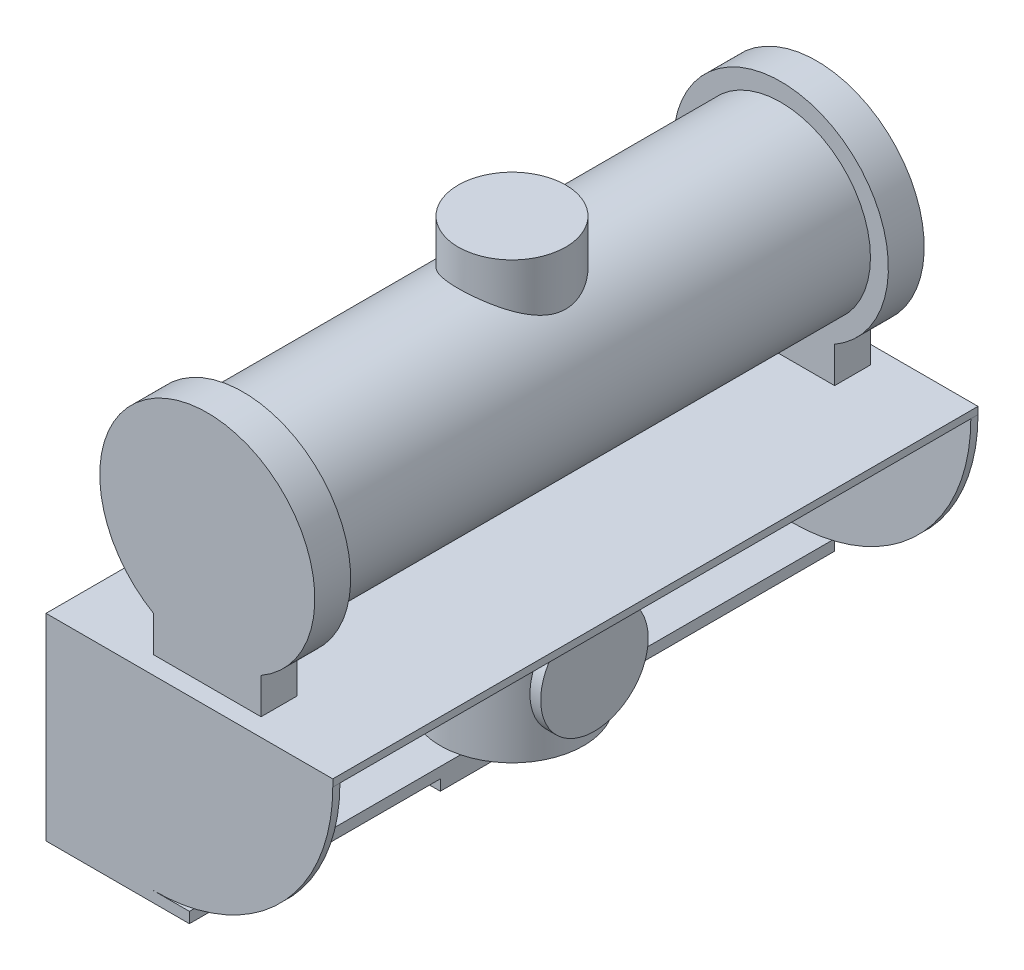
from build123d import *

# Parameters (mm, degrees)
SKETCH1_R            = 25
BOSS_EXTRUDE1_DEPTH  = 150
SKETCH2_R            = 30
BOSS_EXTRUDE2_DEPTH  = 10
BOSS_EXTRUDE3_START  = 10
SKETCH3_R            = 30
BOSS_EXTRUDE3_DEPTH  = 10
SKETCH4_R            = 15
BOSS_EXTRUDE4_DEPTH  = 10
SKETCH5_W            = 30
SKETCH5_H            = 10
BOSS_EXTRUDE5_DEPTH  = 10
SKETCH6_W            = 80
SKETCH6_H            = 180
BOSS_EXTRUDE6_DEPTH  = 2
SKETCH7_W            = 78
SKETCH7_H            = 2
BOSS_EXTRUDE7_DEPTH  = 50
FILLET1_R            = 50
SKETCH8_R            = 20
BOSS_EXTRUDE8_DEPTH  = 45
SKETCH10_R           = 15
BOSS_EXTRUDE9_DEPTH  = 3
SKETCH11_W           = 180
SKETCH11_H           = 3
BOSS_EXTRUDE10_DEPTH = 40
SKETCH12_W           = 40
SKETCH12_H           = 40
BOSS_EXTRUDE11_DEPTH = 3


with BuildPart() as part:
    # Sketch1 → Boss-Extrude1 (new body)
    with BuildSketch(Plane.XY):
        Circle(SKETCH1_R)
    extrude(amount=BOSS_EXTRUDE1_DEPTH)

    # Sketch2 → Boss-Extrude2 (add)
    with BuildSketch(Plane.XY.offset(150)):
        Circle(SKETCH2_R)
    extrude(amount=BOSS_EXTRUDE2_DEPTH)

    # Sketch3 → Boss-Extrude3 (add)
    with BuildSketch(Plane(origin=(0, 0, 0), x_dir=(-1, 0, 0), z_dir=(0, 0, -1)).offset(BOSS_EXTRUDE3_START)):
        with Locations(Location((0, 0, 0), (0, 0, 180))):
            Circle(SKETCH3_R)
    extrude(amount=-BOSS_EXTRUDE3_DEPTH)

    # Sketch4 → Boss-Extrude4 (add, symmetric)
    with BuildSketch(Plane(origin=(0, 25, 0), x_dir=(1, 0, 0), z_dir=(0, 1, 0))):
        with Locations(Location((0, -75, 0), (0, 0, 90))):
            Circle(SKETCH4_R)
    extrude(amount=BOSS_EXTRUDE4_DEPTH, both=True)

    # Sketch5 → Boss-Extrude5 (add)
    with BuildSketch(Plane.XY.offset(160)):
        with Locations((0, -30.980762114)):
            Rectangle(SKETCH5_W, SKETCH5_H)
    boss_extrude5 = extrude(amount=-BOSS_EXTRUDE5_DEPTH)

    # Mirror1: Boss-Extrude5 across plane
    add(boss_extrude5.mirror(Plane.XY.offset(75)))

    # Sketch6 → Boss-Extrude6 (add)
    with BuildSketch(Plane(origin=(0, -35.980762114, 0), x_dir=(-1, 0, 0), z_dir=(0, -1, 0))):
        with Locations((0, -75)):
            Rectangle(SKETCH6_W, SKETCH6_H)
    extrude(amount=BOSS_EXTRUDE6_DEPTH)

    # Sketch7 → Boss-Extrude7 (add)
    with BuildSketch(Plane(origin=(0, -37.980762114, 0), x_dir=(-1, 0, 0), z_dir=(0, -1, 0))):
        Polygon((-40, -163), (-40, -165), (40, -165), (40, -163), (38, -163), align=None)
        Polygon((38, -163), (40, -163), (40, 15), (38, 15), (38, 13), align=None)
        with Locations((-1, 14)):
            Rectangle(SKETCH7_W, SKETCH7_H)
    extrude(amount=BOSS_EXTRUDE7_DEPTH)

    # Fillet1
    fillet1_edges = [part.edges().sort_by_distance(p)[0] for p in [
        (40, -87.980762114, -14),
        (40, -87.980762114, 164),
    ]]
    fillet(fillet1_edges, radius=FILLET1_R)

    # Sketch8 → Boss-Extrude8 (add)
    with BuildSketch(Plane(origin=(0, -37.980762114, 0), x_dir=(-1, 0, 0), z_dir=(0, -1, 0))):
        with Locations(Location((0, -75, 0), (0, 0, 270))):
            Circle(SKETCH8_R)
    extrude(amount=BOSS_EXTRUDE8_DEPTH)

    # Sketch11 → Boss-Extrude10 (add)
    with BuildSketch(Plane.ZY.offset(40)):
        with Locations((75, -89.480762114)):
            Rectangle(SKETCH11_W, SKETCH11_H)
    extrude(amount=-BOSS_EXTRUDE10_DEPTH)

    # Sketch12 → Boss-Extrude11 (add)
    with BuildSketch(Plane(origin=(0, -90.980762114, 0), x_dir=(-1, 0, 0), z_dir=(0, -1, 0))):
        with Locations((20, -75)):
            Rectangle(SKETCH12_W, SKETCH12_H)
    extrude(amount=BOSS_EXTRUDE11_DEPTH)


with BuildPart() as body_2:
    # Sketch10 → Boss-Extrude9 (new body)
    with BuildSketch(Plane(origin=(20, 0, 0), x_dir=(0, 0, -1), z_dir=(1, 0, 0))):
        with Locations((-75, -62.980762114)):
            Circle(SKETCH10_R)
    extrude(amount=BOSS_EXTRUDE9_DEPTH)


solid = Compound([part.part, body_2.part])
